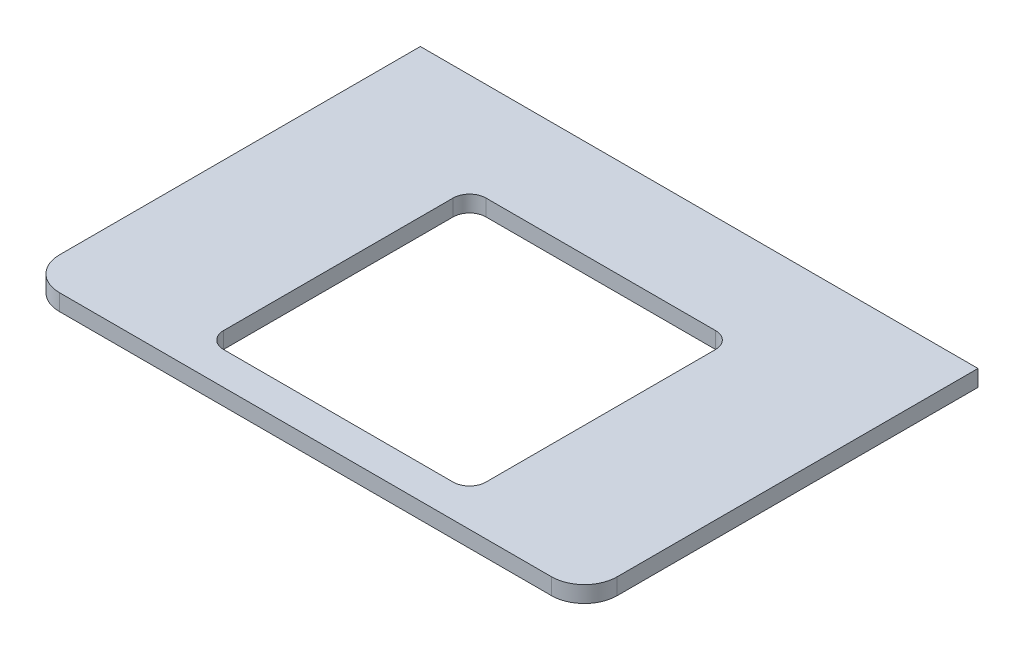
from build123d import *

# Parameters (mm, degrees)
ESQUISSE1_W             = 215.9
ESQUISSE1_H             = 152.4
BOSS_EXTRU_1_DEPTH      = 6.35
CONG_1_R                = 12.7
ENL_V_MAT_EXTRU_1_DEPTH = 133.287433266


with BuildPart() as part:
    # Esquisse1 → Boss.-Extru.1 (new body)
    with BuildSketch(Plane(origin=(0, 0, 0), x_dir=(1, 0, 0), z_dir=(0, 1, 0))):
        Rectangle(ESQUISSE1_W, ESQUISSE1_H)
    extrude(amount=BOSS_EXTRU_1_DEPTH)

    # Congé1
    cong_1_edges = [part.edges().sort_by_distance(p)[0] for p in [
        (107.95, 3.175, 76.2),
        (-107.95, 3.175, 76.2),
    ]]
    fillet(cong_1_edges, radius=CONG_1_R)

    # Esquisse2 → Enlèv. mat.-Extru.1 (cut, through all)
    with BuildSketch(Plane(origin=(0, 6.35, 0), x_dir=(1, 0, 0), z_dir=(0, 1, 0))):
        with BuildLine():
            Line((-44.45, 38.1), (44.45, 38.1))
            ThreePointArc((44.45, 38.1), (48.940128061, 36.240128061), (50.8, 31.75))
            Line((50.8, 31.75), (50.8, -57.15))
            ThreePointArc((50.8, -57.15), (48.940128061, -61.640128061), (44.45, -63.5))
            Line((44.45, -63.5), (-44.45, -63.5))
            ThreePointArc((-44.45, -63.5), (-48.940128061, -61.640128061), (-50.8, -57.15))
            Line((-50.8, -57.15), (-50.8, 31.75))
            ThreePointArc((-50.8, 31.75), (-48.940128061, 36.240128061), (-44.45, 38.1))
        make_face()
    extrude(amount=-ENL_V_MAT_EXTRU_1_DEPTH, mode=Mode.SUBTRACT)


solid = part.part
